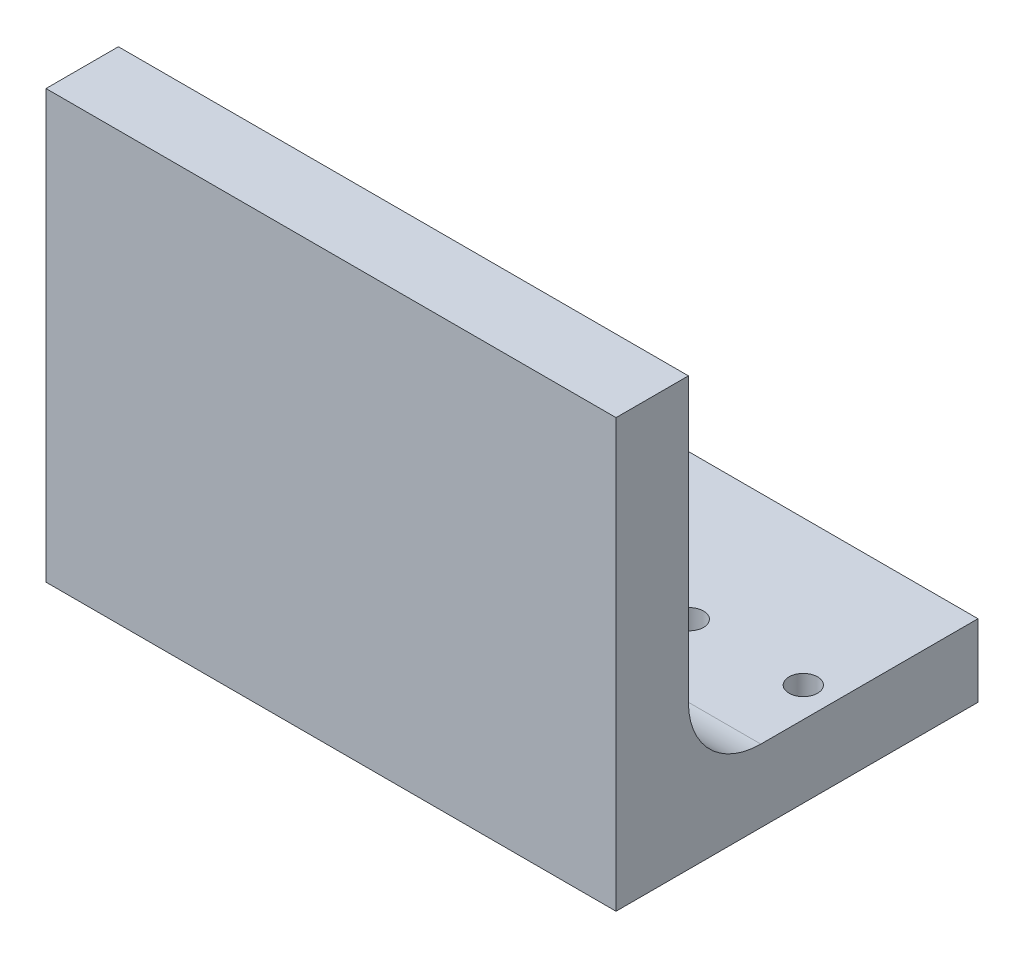
from build123d import *

# Parameters (mm, degrees)
SKETCH1_W           = 20
SKETCH1_H           = 15
BOSS_EXTRUDE1_DEPTH = 2.54
SKETCH2_W           = 20
SKETCH2_H           = 2.54
BOSS_EXTRUDE2_DEPTH = 10.16
CUT_EXTRUDE1_REACH  = 20.933
SKETCH3_R           = 2.4765
FILLET1_R           = 2.54
SKETCH4_R           = 0.5
CUT_EXTRUDE2_DEPTH  = 10


with BuildPart() as part:
    # Sketch1 → Boss-Extrude1 (new body)
    with BuildSketch(Plane.XY):
        with Locations((0, 7.5)):
            Rectangle(SKETCH1_W, SKETCH1_H)
    extrude(amount=BOSS_EXTRUDE1_DEPTH)

    # Sketch2 → Boss-Extrude2 (add)
    with BuildSketch(Plane(origin=(0, 0, 0), x_dir=(-1, 0, 0), z_dir=(0, 0, -1))):
        with Locations((0, 1.27)):
            Rectangle(SKETCH2_W, SKETCH2_H)
    extrude(amount=BOSS_EXTRUDE2_DEPTH)

    # Sketch3 → Cut-Extrude1 (cut, up to next)
    with BuildSketch(Plane(origin=(0, 2.54, 0), x_dir=(1, 0, 0), z_dir=(0, 1, 0)), mode=Mode.PRIVATE) as cut_extrude1_sk1:
        with Locations(Location((0, 5.08, 0), (0, 0, 180))):
            Circle(SKETCH3_R)
    cut_extrude1_tool1 = extrude(cut_extrude1_sk1.sketch, amount=-CUT_EXTRUDE1_REACH, mode=Mode.PRIVATE) & part.part
    add(cut_extrude1_tool1.solids().sort_by_distance((0, 2.54, -5.08))[0], mode=Mode.SUBTRACT)

    # Fillet1
    fillet1_edges = [part.edges().sort_by_distance(p)[0] for p in [
        (0, 2.54, 0),
    ]]
    fillet(fillet1_edges, radius=FILLET1_R)

    # Sketch4 → Cut-Extrude2 (cut)
    with BuildSketch(Plane(origin=(0, 2.54, 0), x_dir=(1, 0, 0), z_dir=(0, 1, 0))):
        with Locations(Location((-8.35, 5.08, 0), (0, 0, 180))):
            Circle(SKETCH4_R)
        with Locations(Location((-4.35, 5.08, 0), (0, 0, 180))):
            Circle(SKETCH4_R)
        with Locations(Location((4.95, 5.08, 0), (0, 0, 180))):
            Circle(SKETCH4_R)
        with Locations(Location((8.95, 5.08, 0), (0, 0, 180))):
            Circle(SKETCH4_R)
    extrude(amount=-CUT_EXTRUDE2_DEPTH, mode=Mode.SUBTRACT)


solid = part.part
